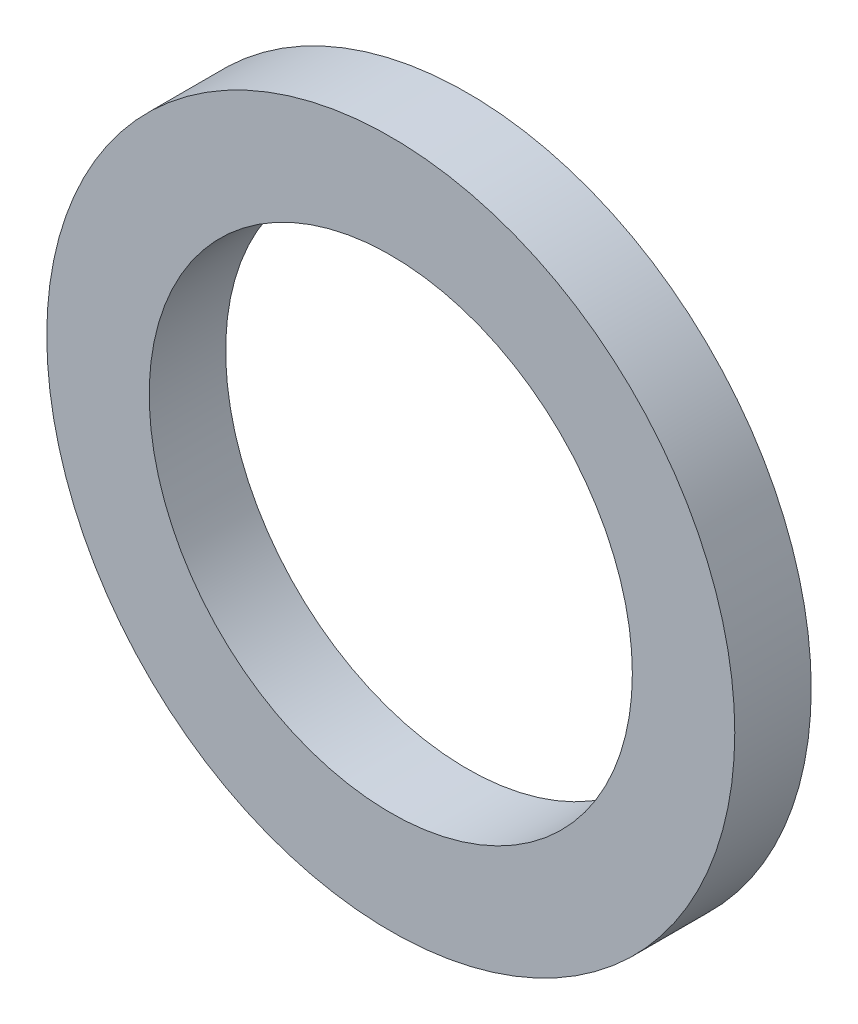
from build123d import *

# Parameters (mm, degrees)
SKETCH1_R           = 7.14375
SKETCH1_R_2         = 5.0165
BOSS_EXTRUDE1_DEPTH = 1.5875


with BuildPart() as part:
    # Sketch1 → Boss-Extrude1 (new body)
    with BuildSketch(Plane.XY):
        Circle(SKETCH1_R)
        Circle(SKETCH1_R_2, mode=Mode.SUBTRACT)
    extrude(amount=BOSS_EXTRUDE1_DEPTH)


solid = part.part
